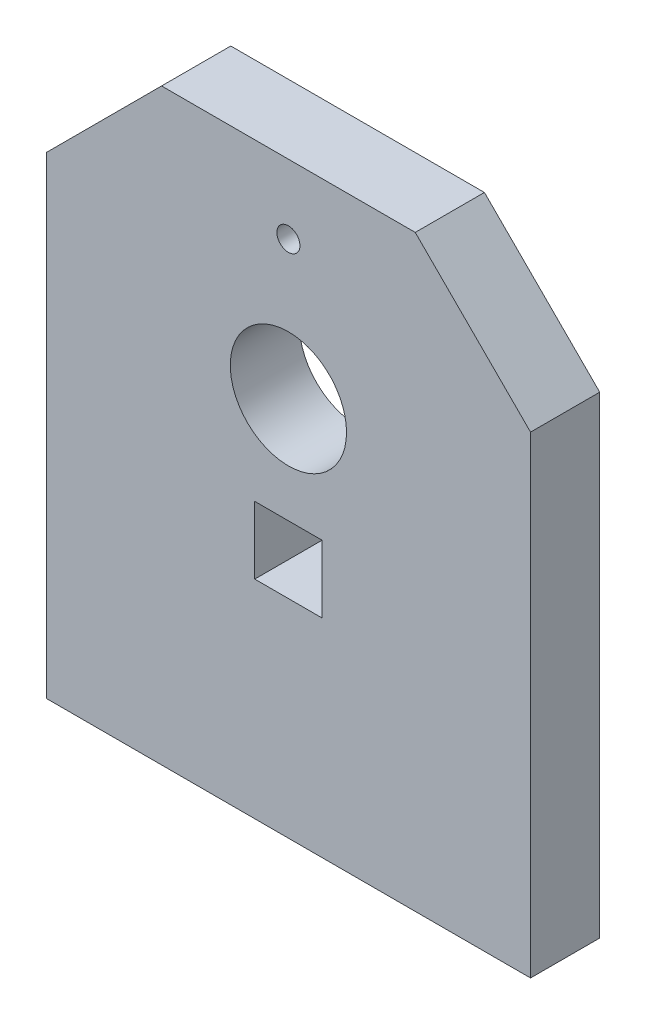
from build123d import *

# Parameters (mm, degrees)
SKETCH1_W           = 2.92
SKETCH1_H           = 2.92
SKETCH1_R           = 2.52
SKETCH1_R_2         = 0.5
BOSS_EXTRUDE1_DEPTH = 3


with BuildPart() as part:
    # Sketch1 → Boss-Extrude1 (new body)
    with BuildSketch(Plane.XY):
        Polygon((13.5482559, 6.709731544), (8.5482559, 11.709731544), (-2.4517441, 11.709731544), (-7.4517441, 6.709731544), (-7.4517441, -13.790268456), (13.5482559, -13.790268456), align=None)
        with Locations((3.0482559, -3.330268456)):
            Rectangle(SKETCH1_W, SKETCH1_H, mode=Mode.SUBTRACT)
        with Locations((3.0482559, 2.709731544)):
            Circle(SKETCH1_R, mode=Mode.SUBTRACT)
        with Locations((3.0482559, 8.709731544)):
            Circle(SKETCH1_R_2, mode=Mode.SUBTRACT)
    extrude(amount=BOSS_EXTRUDE1_DEPTH)


solid = part.part
